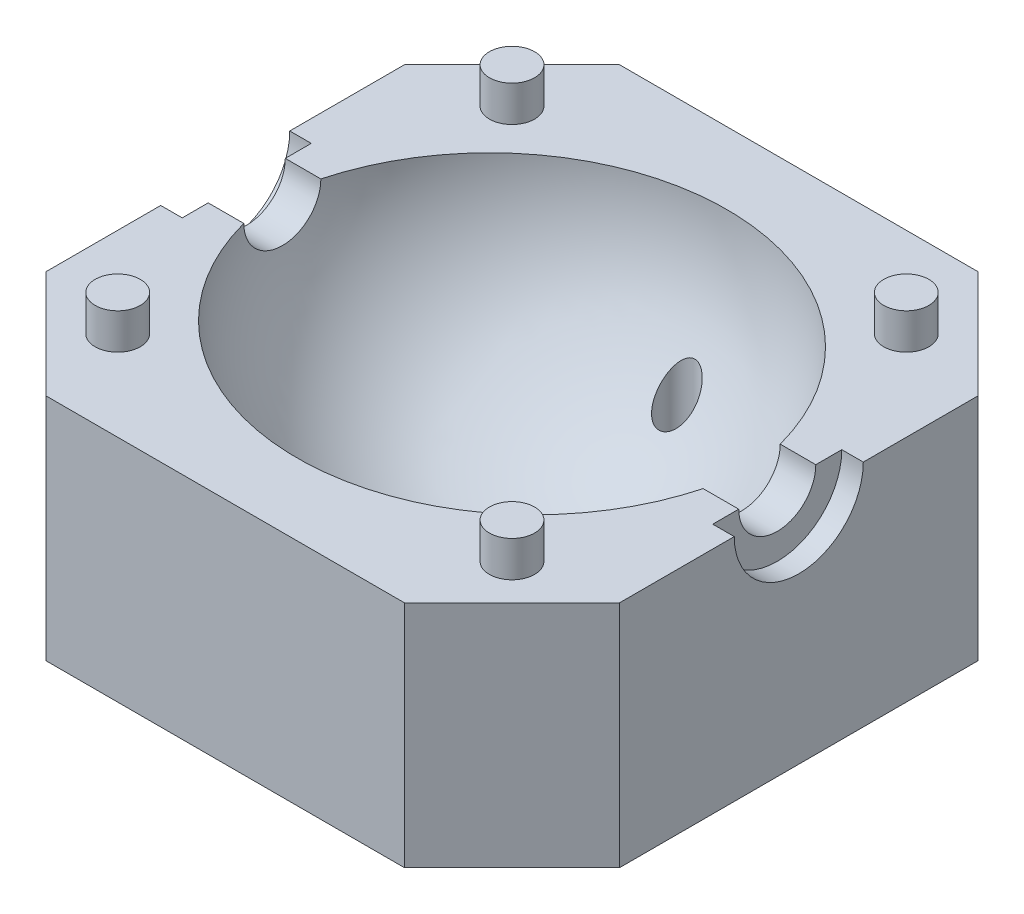
from build123d import *

# Parameters (mm, degrees)
SKETCH1_W           = 80
SKETCH1_H           = 80
BOSS_EXTRUDE1_DEPTH = 32
SKETCH3_R           = 5.375
CUT_EXTRUDE1_DEPTH  = 95.994736856
CHAMFER1_SIZE       = 15
SKETCH5_R           = 9
CUT_EXTRUDE3_DEPTH  = 93.482430925
SKETCH4_R           = 3.15
BOSS_EXTRUDE3_DEPTH = 5
CUT_EXTRUDE4_REACH  = 69.594
SKETCH6_R           = 2.5
FILLET1_R           = 6


with BuildPart() as part:
    # Sketch1 → Boss-Extrude1 (new body)
    with BuildSketch(Plane(origin=(0, 0, 0), x_dir=(1, 0, 0), z_dir=(0, 1, 0))):
        Rectangle(SKETCH1_W, SKETCH1_H)
    extrude(amount=BOSS_EXTRUDE1_DEPTH)

    # Sketch2 → Cut-Revolve1 (revolve, cut)
    with BuildSketch(Plane(origin=(0, 32, 0), x_dir=(1, 0, 0), z_dir=(0, 1, 0))):
        with BuildLine():
            Line((-33, 0), (33, 0))
            ThreePointArc((33, 0), (0, -30), (-33, 0))
        make_face()
    revolve(axis=Axis((-33, 32, 0), (1, 0, 0)), mode=Mode.SUBTRACT)

    # Sketch3 → Cut-Extrude1 (cut, through all)
    with BuildSketch(Plane.ZY.offset(40)):
        with Locations((0, 32)):
            Circle(SKETCH3_R)
    extrude(amount=-CUT_EXTRUDE1_DEPTH, mode=Mode.SUBTRACT)

    # Chamfer1
    chamfer1_edges = [part.edges().sort_by_distance(p)[0] for p in [
        (40, 16, 40),
        (-40, 16, 40),
        (-40, 16, -40),
        (40, 16, -40),
    ]]
    chamfer(chamfer1_edges, length=CHAMFER1_SIZE)

    # Sketch5 → Cut-Extrude3 (cut, through all)
    with BuildSketch(Plane.ZY.offset(37)):
        with Locations((0, 32)):
            Circle(SKETCH5_R)
    cut_extrude3 = extrude(amount=CUT_EXTRUDE3_DEPTH, mode=Mode.SUBTRACT)

    # Mirror1: Cut-Extrude3 across plane
    add(cut_extrude3.mirror(Plane(origin=(0, 0, 0), x_dir=(0, 0, 1), z_dir=(1, 0, 0))), mode=Mode.SUBTRACT)

    # Sketch4 → Boss-Extrude3 (add)
    with BuildSketch(Plane(origin=(0, 32, 0), x_dir=(1, 0, 0), z_dir=(0, 1, 0))):
        with Locations(Location((-27.5, 27.5, 0), (0, 0, 270))):
            Circle(SKETCH4_R)
        with Locations(Location((27.5, 27.5, 0), (0, 0, 270))):
            Circle(SKETCH4_R)
        with Locations(Location((27.5, -27.5, 0), (0, 0, 270))):
            Circle(SKETCH4_R)
        with Locations(Location((-27.5, -27.5, 0), (0, 0, 270))):
            Circle(SKETCH4_R)
    extrude(amount=BOSS_EXTRUDE3_DEPTH)

    # Sketch6 → Cut-Extrude4 (cut, up to next)
    with BuildSketch(Plane.XZ, mode=Mode.PRIVATE) as cut_extrude4_sk1:
        with Locations(Location((0, -23, 0), (0, 0, 270))):
            Circle(SKETCH6_R)
    cut_extrude4_tool1 = extrude(cut_extrude4_sk1.sketch, amount=-CUT_EXTRUDE4_REACH, mode=Mode.PRIVATE) & part.part
    # Sketch6 → Cut-Extrude4 (cut, up to next)
    with BuildSketch(Plane.XZ, mode=Mode.PRIVATE) as cut_extrude4_sk2:
        with Locations(Location((0, 23, 0), (0, 0, 229.659534443))):
            Circle(SKETCH6_R)
    cut_extrude4_tool2 = extrude(cut_extrude4_sk2.sketch, amount=-CUT_EXTRUDE4_REACH, mode=Mode.PRIVATE) & part.part
    # Sketch6 → Cut-Extrude4 (cut, up to next)
    with BuildSketch(Plane.XZ, mode=Mode.PRIVATE) as cut_extrude4_sk3:
        with Locations(Location((0, 0, 0), (0, 0, 270))):
            Circle(SKETCH6_R)
    cut_extrude4_tool3 = extrude(cut_extrude4_sk3.sketch, amount=-CUT_EXTRUDE4_REACH, mode=Mode.PRIVATE) & part.part
    add(cut_extrude4_tool1.solids().sort_by_distance((0, 0, -23))[0], mode=Mode.SUBTRACT)
    add(cut_extrude4_tool2.solids().sort_by_distance((0, 0, 23))[0], mode=Mode.SUBTRACT)
    add(cut_extrude4_tool3.solids().sort_by_distance((0, 0, 0))[0], mode=Mode.SUBTRACT)

    # Fillet1
    fillet1_edges = [part.edges().sort_by_distance(p)[0] for p in [
        (0, 0, -20.5),
        (1.618320645, 0, 24.905528349),
    ]]
    fillet(fillet1_edges, radius=FILLET1_R)


solid = part.part
